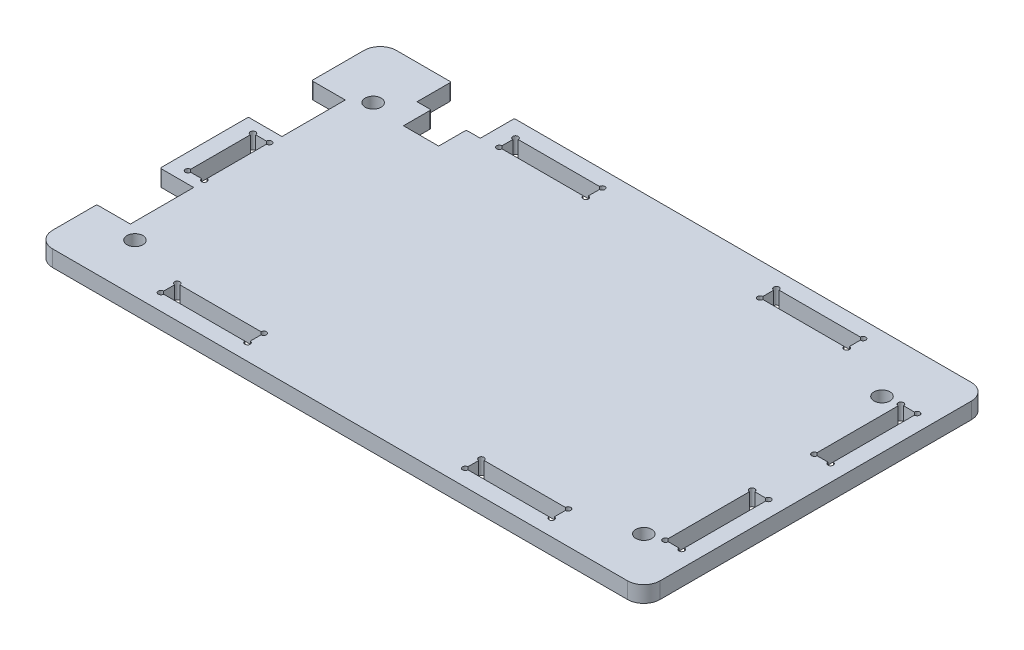
from build123d import *

# Parameters (mm, degrees)
SKETCH1_R           = 1.4732
BOSS_EXTRUDE1_DEPTH = 3


with BuildPart() as part:
    # Sketch1 → Boss-Extrude1 (new body)
    with BuildSketch(Plane(origin=(0, 0, 0), x_dir=(1, 0, 0), z_dir=(0, 1, 0))):
        with BuildLine():
            Line((-33.75, 25.45), (-31.41, 25.45))
            Line((-31.41, 25.45), (-31.41, 31.5))
            ThreePointArc((-31.41, 31.5), (-31.336776695, 31.676776695), (-31.16, 31.75))
            Line((-31.16, 31.75), (53, 31.75))
            ThreePointArc((53, 31.75), (55.121320344, 30.871320344), (56, 28.75))
            Line((56, 28.75), (56, -28.75))
            ThreePointArc((56, -28.75), (55.121320344, -30.871320344), (53, -31.75))
            Line((53, -31.75), (-53.2, -31.75))
            ThreePointArc((-53.2, -31.75), (-55.321320344, -30.871320344), (-56.2, -28.75))
            Line((-56.2, -28.75), (-56.2, -20.85))
            ThreePointArc((-56.2, -20.85), (-56.126776695, -20.673223305), (-55.95, -20.6))
            Line((-55.95, -20.6), (-50, -20.6))
            Line((-50, -20.6), (-50, -8.9))
            Line((-50, -8.9), (-55.95, -8.9))
            ThreePointArc((-55.95, -8.9), (-56.126776695, -8.826776695), (-56.2, -8.65))
            Line((-56.2, -8.65), (-56.2, 7.15))
            ThreePointArc((-56.2, 7.15), (-56.126776695, 7.326776695), (-55.95, 7.4))
            Line((-55.95, 7.4), (-50, 7.4))
            Line((-50, 7.4), (-50, 19.1))
            Line((-50, 19.1), (-55.95, 19.1))
            ThreePointArc((-55.95, 19.1), (-56.126776695, 19.173223305), (-56.2, 19.35))
            Line((-56.2, 19.35), (-56.2, 28.75))
            ThreePointArc((-56.2, 28.75), (-55.321320344, 30.871320344), (-53.2, 31.75))
            Line((-53.2, 31.75), (-43.34, 31.75))
            ThreePointArc((-43.34, 31.75), (-43.163223305, 31.676776695), (-43.09, 31.5))
            Line((-43.09, 31.5), (-43.09, 25.45))
            Line((-43.09, 25.45), (-40.75, 25.45))
            ThreePointArc((-40.75, 25.45), (-40.573223305, 25.376776695), (-40.5, 25.2))
            Line((-40.5, 25.2), (-40.5, 20.35))
            Line((-40.5, 20.35), (-34, 20.35))
            Line((-34, 20.35), (-34, 25.2))
            ThreePointArc((-34, 25.2), (-33.926776695, 25.376776695), (-33.75, 25.45))
        make_face()
        with Locations(Location((-47, 21.25, 0), (0, 0, 270))):
            Circle(SKETCH1_R, mode=Mode.SUBTRACT)
        with Locations(Location((-47, -22.75, 0), (0, 0, 270))):
            Circle(SKETCH1_R, mode=Mode.SUBTRACT)
        with Locations(Location((47, -22.75, 0), (0, 0, 270))):
            Circle(SKETCH1_R, mode=Mode.SUBTRACT)
        with Locations(Location((47, 21.25, 0), (0, 0, 270))):
            Circle(SKETCH1_R, mode=Mode.SUBTRACT)
        with BuildLine():
            Line((-52.699999734, -6.75), (-50.699999734, -6.75))
            ThreePointArc((-50.699999734, -6.75), (-49.84644625, -7.103553297), (-50.2, -6.25))
            Line((-50.2, -6.25), (-50.2, 4.749999991))
            ThreePointArc((-50.2, 4.749999991), (-49.846447452, 5.603553619), (-50.700000632, 5.25))
            Line((-50.700000632, 5.25), (-52.700000632, 5.25))
            ThreePointArc((-52.700000632, 5.25), (-53.553554237, 5.603553165), (-53.2, 4.75))
            Line((-53.2, 4.75), (-53.2, -6.25))
            ThreePointArc((-53.2, -6.25), (-53.553553031, -7.103553485), (-52.699999734, -6.75))
        make_face(mode=Mode.SUBTRACT)
        with BuildLine():
            Line((-28.2, 28.249999625), (-28.2, 26.249999625))
            ThreePointArc((-28.2, 26.249999625), (-28.553553309, 25.396446153), (-27.7, 25.749999854))
            Line((-27.7, 25.749999854), (-12.7, 25.749999854))
            ThreePointArc((-12.7, 25.749999854), (-11.846446528, 25.396446775), (-12.2, 26.250000084))
            Line((-12.2, 26.250000084), (-12.2, 28.250000084))
            ThreePointArc((-12.2, 28.250000084), (-11.846446639, 29.103553504), (-12.7, 28.75))
            Line((-12.7, 28.75), (-27.7, 28.75))
            ThreePointArc((-27.7, 28.75), (-28.553553523, 29.103552882), (-28.2, 28.249999625))
        make_face(mode=Mode.SUBTRACT)
        with BuildLine():
            Line((20, 28.249999625), (20, 26.249999625))
            ThreePointArc((20, 26.249999625), (19.646446691, 25.396446153), (20.5, 25.749999854))
            Line((20.5, 25.749999854), (35.5, 25.749999854))
            ThreePointArc((35.5, 25.749999854), (36.353553472, 25.396446775), (36, 26.250000084))
            Line((36, 26.250000084), (36, 28.250000084))
            ThreePointArc((36, 28.250000084), (36.353553361, 29.103553504), (35.5, 28.75))
            Line((35.5, 28.75), (20.5, 28.75))
            ThreePointArc((20.5, 28.75), (19.646446477, 29.103552882), (20, 28.249999625))
        make_face(mode=Mode.SUBTRACT)
        with BuildLine():
            Line((-36.2, -26.250000146), (-36.2, -28.250000146))
            ThreePointArc((-36.2, -28.250000146), (-36.553553309, -29.103553617), (-35.7, -28.749999916))
            Line((-35.7, -28.749999916), (-20.7, -28.749999916))
            ThreePointArc((-20.7, -28.749999916), (-19.846446528, -29.103552995), (-20.2, -28.249999686))
            Line((-20.2, -28.249999686), (-20.2, -26.249999686))
            ThreePointArc((-20.2, -26.249999686), (-19.846446639, -25.396446266), (-20.7, -25.74999977))
            Line((-20.7, -25.74999977), (-35.7, -25.74999977))
            ThreePointArc((-35.7, -25.74999977), (-36.553553523, -25.396446888), (-36.2, -26.250000146))
        make_face(mode=Mode.SUBTRACT)
        with BuildLine():
            Line((20, -26.250000146), (20, -28.250000146))
            ThreePointArc((20, -28.250000146), (19.646446691, -29.103553617), (20.5, -28.749999916))
            Line((20.5, -28.749999916), (35.5, -28.749999916))
            ThreePointArc((35.5, -28.749999916), (36.353553472, -29.103552995), (36, -28.249999686))
            Line((36, -28.249999686), (36, -26.249999686))
            ThreePointArc((36, -26.249999686), (36.353553361, -25.396446266), (35.5, -25.74999977))
            Line((35.5, -25.74999977), (20.5, -25.74999977))
            ThreePointArc((20.5, -25.74999977), (19.646446477, -25.396446888), (20, -26.250000146))
        make_face(mode=Mode.SUBTRACT)
        with BuildLine():
            Line((50.500000146, -21.75), (52.500000146, -21.75))
            ThreePointArc((52.500000146, -21.75), (53.353553617, -22.103553309), (52.999999916, -21.25))
            Line((52.999999916, -21.25), (52.999999916, -6.25))
            ThreePointArc((52.999999916, -6.25), (53.353552995, -5.396446528), (52.499999686, -5.75))
            Line((52.499999686, -5.75), (50.499999686, -5.75))
            ThreePointArc((50.499999686, -5.75), (49.646446266, -5.396446639), (49.99999977, -6.25))
            Line((49.99999977, -6.25), (49.99999977, -21.25))
            ThreePointArc((49.99999977, -21.25), (49.646446888, -22.103553523), (50.500000146, -21.75))
        make_face(mode=Mode.SUBTRACT)
        with BuildLine():
            Line((50.500000146, 5.75), (52.500000146, 5.75))
            ThreePointArc((52.500000146, 5.75), (53.353553617, 5.396446691), (52.999999916, 6.25))
            Line((52.999999916, 6.25), (52.999999916, 21.25))
            ThreePointArc((52.999999916, 21.25), (53.353552995, 22.103553472), (52.499999686, 21.75))
            Line((52.499999686, 21.75), (50.499999686, 21.75))
            ThreePointArc((50.499999686, 21.75), (49.646446266, 22.103553361), (49.99999977, 21.25))
            Line((49.99999977, 21.25), (49.99999977, 6.25))
            ThreePointArc((49.99999977, 6.25), (49.646446888, 5.396446477), (50.500000146, 5.75))
        make_face(mode=Mode.SUBTRACT)
    extrude(amount=BOSS_EXTRUDE1_DEPTH)


solid = part.part
